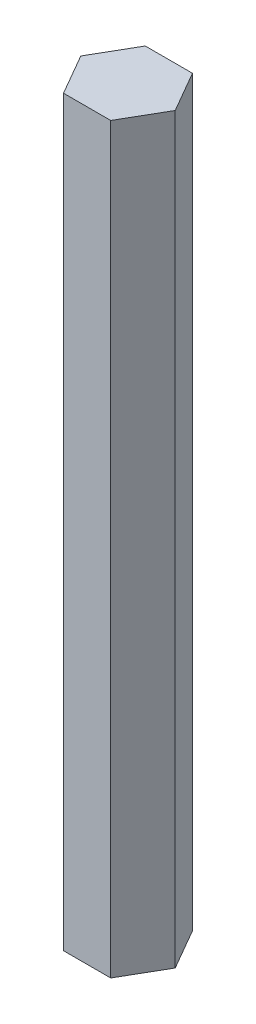
from build123d import *

# Parameters (mm, degrees)
BOSS_EXTRUDE1_DEPTH      = 16.55
BOSS_EXTRUDE1_DEPTH_BACK = 10.702034


with BuildPart() as part:
    # Sketch1 → Boss-Extrude1 (new, two sides: drawn at the far end of the back side and taken through both)
    with BuildSketch(Plane(origin=(0, 0, 0), x_dir=(1, 0, 0), z_dir=(0, 1, 0)).offset(-BOSS_EXTRUDE1_DEPTH_BACK)):
        Polygon((1.732050808, 0), (0.866025404, 1.5), (-0.866025404, 1.5), (-1.732050808, 0), (-0.866025404, -1.5), (0.866025404, -1.5), align=None)
    extrude(amount=BOSS_EXTRUDE1_DEPTH + BOSS_EXTRUDE1_DEPTH_BACK)


solid = part.part
